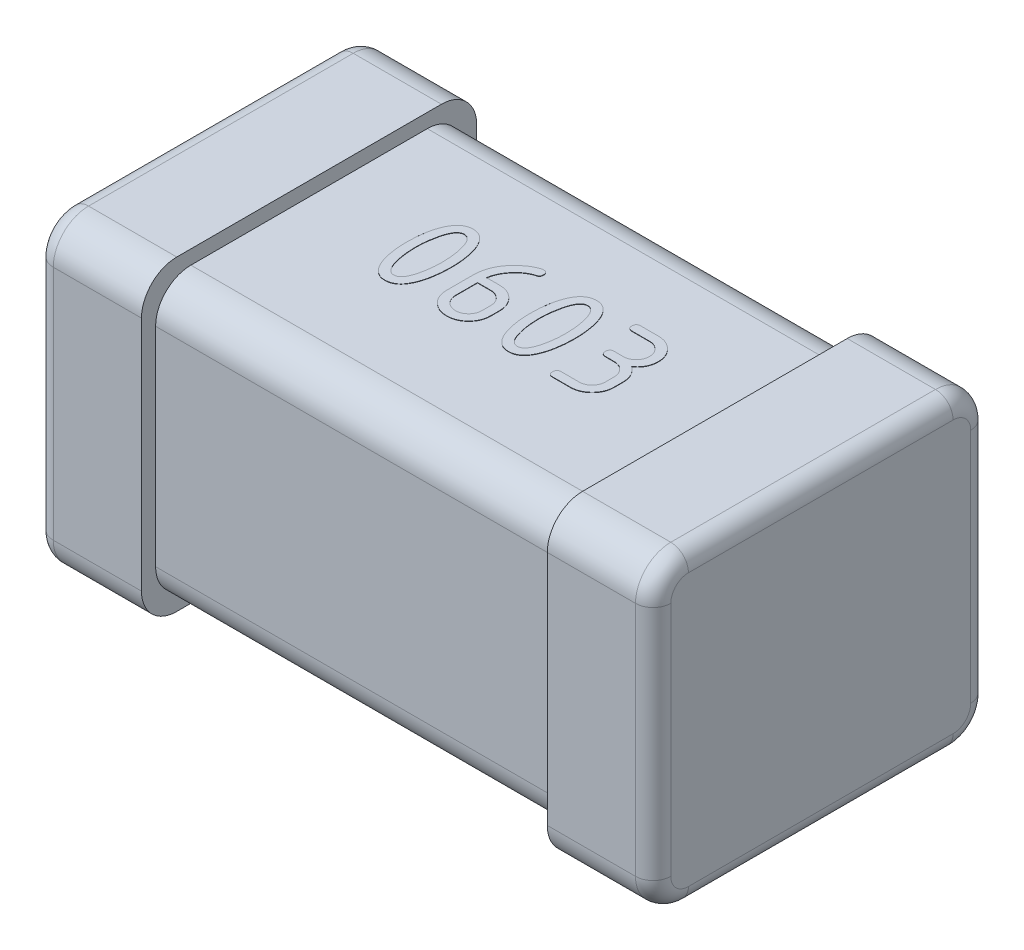
from build123d import *

# Parameters (mm, degrees)
SKETCH1_W               = 1.75
SKETCH1_H               = 0.95
BOSS_EXTRUDE1_DEPTH     = 0.435
CUT_EXTRUDE1_DEPTH      = 0.575
CUT_EXTRUDE1_DEPTH_BACK = 0.575
SKETCH3_OUTSIDE_W       = 3.384
SKETCH3_OUTSIDE_H       = 3.304
SKETCH3_OUTSIDE_W_2     = 0.87
SKETCH3_OUTSIDE_H_2     = 0.79
FILLET1_R               = 0.1
FILLET2_R               = 0.1
FILLET3_R               = 0.05
BOSS_EXTRUDE2_DEPTH     = 0.001


with BuildPart() as part:
    # Sketch1 → Boss-Extrude1 (new, symmetric)
    with BuildSketch(Plane(origin=(0, 0, 0), x_dir=(1, 0, 0), z_dir=(0, 1, 0))):
        Rectangle(SKETCH1_W, SKETCH1_H)
    extrude(amount=BOSS_EXTRUDE1_DEPTH, both=True)

    # Sketch3 outside → Cut-Extrude1 (cut, two sides: drawn at the far end of the back side and taken through both)
    with BuildSketch(Plane(origin=(0, 0, 0), x_dir=(0, 0, -1), z_dir=(1, 0, 0)).offset(-CUT_EXTRUDE1_DEPTH_BACK)):
        Rectangle(SKETCH3_OUTSIDE_W, SKETCH3_OUTSIDE_H)
        Rectangle(SKETCH3_OUTSIDE_W_2, SKETCH3_OUTSIDE_H_2, mode=Mode.SUBTRACT)
    extrude(amount=CUT_EXTRUDE1_DEPTH + CUT_EXTRUDE1_DEPTH_BACK, mode=Mode.SUBTRACT)

    # Fillet1
    fillet1_edges = [part.edges().sort_by_distance(p)[0] for p in [
        (0, -0.395, 0.435),
        (0, -0.395, -0.435),
        (0, 0.395, -0.435),
        (0, 0.395, 0.435),
    ]]
    fillet(fillet1_edges, radius=FILLET1_R)

    # Fillet2
    fillet2_edges = [part.edges().sort_by_distance(p)[0] for p in [
        (-0.725, 0.435, 0.475),
        (0.725, -0.435, 0.475),
        (-0.725, -0.435, -0.475),
        (-0.725, 0.435, -0.475),
        (0.725, 0.435, 0.475),
        (-0.725, -0.435, 0.475),
        (0.725, -0.435, -0.475),
        (0.725, 0.435, -0.475),
    ]]
    fillet(fillet2_edges, radius=FILLET2_R)

    # Fillet3
    fillet3_edges = [part.edges().sort_by_distance(p)[0] for p in [
        (-0.875, 0, 0.475),
        (-0.875, -0.435, 0),
        (-0.875, 0.435, 0),
        (-0.875, 0, -0.475),
        (-0.875, 0.405710678, -0.445710678),
        (-0.875, -0.405710678, -0.445710678),
        (-0.875, 0.405710678, 0.445710678),
        (-0.875, -0.405710678, 0.445710678),
        (0.875, 0.435, 0),
        (0.875, -0.435, 0),
        (0.875, 0, -0.475),
        (0.875, 0, 0.475),
        (0.875, -0.405710678, -0.445710678),
        (0.875, 0.405710678, -0.445710678),
        (0.875, -0.405710678, 0.445710678),
        (0.875, 0.405710678, 0.445710678),
    ]]
    fillet(fillet3_edges, radius=FILLET3_R)

    # Sketch4 → Boss-Extrude2 (add)
    # profile 1 of 4: a face of its own
    with BuildSketch(Plane(origin=(0, 0.395, 0), x_dir=(1, 0, 0), z_dir=(0, 1, 0))):
        with BuildLine():
            add(Edge.make_bspline(
                [(-0.2, 0.02730046), (-0.200033044, 0.023635617), (-0.20009799, 0.0164326), (-0.200582622, 0.00581958), (-0.201516315, -0.004410059), (-0.20262941, -0.014268898), (-0.204220371, -0.02373977), (-0.206116434, -0.032842832), (-0.208302775, -0.041591073), (-0.21010796, -0.047224568), (-0.210993304, -0.049987486)],
                knots=[0, 0, 0, 0, 1.121884543, 2.204992808, 3.251003932, 4.265943523, 5.241379217, 6.189508073, 7.112053941, 8, 8, 8, 8], degree=3))
            add(Edge.make_bspline(
                [(-0.210993304, -0.049987486), (-0.212342568, -0.053742483), (-0.214922293, -0.060921849), (-0.21992219, -0.070660434), (-0.225420323, -0.078997943), (-0.231620372, -0.08581499), (-0.238430946, -0.091168855), (-0.245901151, -0.09500186), (-0.254011373, -0.097314213), (-0.259639018, -0.09756967), (-0.2625, -0.09769954)],
                knots=[0, 0, 0, 0, 1.267950427, 2.424258098, 3.472816797, 4.435939713, 5.342465326, 6.213003319, 7.091526505, 8, 8, 8, 8], degree=3))
            add(Edge.make_bspline(
                [(-0.2625, -0.09769954), (-0.265360763, -0.097569393), (-0.270987977, -0.097313392), (-0.279101339, -0.095005008), (-0.28654948, -0.091162197), (-0.293399874, -0.085877638), (-0.299559534, -0.079056369), (-0.30508107, -0.070777463), (-0.310089072, -0.061075843), (-0.312659414, -0.053910641), (-0.314006696, -0.050154897)],
                knots=[0, 0, 0, 0, 0.910041478, 1.790080955, 2.662121456, 3.566587881, 4.531373102, 5.576831042, 6.729861149, 8, 8, 8, 8], degree=3))
            add(Edge.make_bspline(
                [(-0.314006696, -0.050154897), (-0.3148921, -0.047391989), (-0.316697408, -0.041758513), (-0.318882794, -0.033010118), (-0.320786397, -0.023889701), (-0.322364409, -0.014398102), (-0.323488366, -0.004503555), (-0.324414162, 0.005745483), (-0.324903524, 0.016395323), (-0.324967413, 0.023616991), (-0.325, 0.02730046)],
                knots=[0, 0, 0, 0, 0.886064917, 1.806656342, 2.752776557, 3.731751904, 4.744541313, 5.793997073, 6.874810739, 8, 8, 8, 8], degree=3))
            add(Edge.make_bspline(
                [(-0.325, 0.02730046), (-0.324967413, 0.030983929), (-0.324903524, 0.038205597), (-0.324414162, 0.048855437), (-0.323488366, 0.059104475), (-0.322364409, 0.068999022), (-0.320786397, 0.078490621), (-0.318882794, 0.087611038), (-0.316697408, 0.096359433), (-0.3148921, 0.101992909), (-0.314006696, 0.104755817)],
                knots=[0, 0, 0, 0, 1.125189261, 2.206002927, 3.255458687, 4.268248096, 5.247223443, 6.193343658, 7.113935083, 8, 8, 8, 8], degree=3))
            add(Edge.make_bspline(
                [(-0.314006696, 0.104755817), (-0.312659414, 0.108511561), (-0.310089072, 0.115676763), (-0.30508107, 0.125378383), (-0.299559534, 0.13365729), (-0.293399874, 0.140478559), (-0.28654948, 0.145763117), (-0.279101339, 0.149605928), (-0.270987977, 0.151914312), (-0.265360763, 0.152170314), (-0.2625, 0.15230046)],
                knots=[0, 0, 0, 0, 1.270138851, 2.423168958, 3.468626898, 4.433412119, 5.337878544, 6.209919045, 7.089958522, 8, 8, 8, 8], degree=3))
            add(Edge.make_bspline(
                [(-0.2625, 0.15230046), (-0.259639018, 0.152170591), (-0.254011373, 0.151915133), (-0.245901151, 0.149602781), (-0.238430946, 0.145769775), (-0.231620372, 0.14041591), (-0.225420323, 0.133598863), (-0.21992219, 0.125261354), (-0.214922293, 0.115522769), (-0.212342568, 0.108343403), (-0.210993304, 0.104588407)],
                knots=[0, 0, 0, 0, 0.908473495, 1.786996681, 2.657534674, 3.564060287, 4.527183203, 5.575741902, 6.732049573, 8, 8, 8, 8], degree=3))
            add(Edge.make_bspline(
                [(-0.210993304, 0.104588407), (-0.21010796, 0.101825489), (-0.208302775, 0.096191993), (-0.206116434, 0.087443752), (-0.204220371, 0.078340691), (-0.20262941, 0.068869818), (-0.201516315, 0.05901098), (-0.200582622, 0.048781341), (-0.20009799, 0.03816832), (-0.200033044, 0.030965304), (-0.2, 0.02730046)],
                knots=[0, 0, 0, 0, 0.887946059, 1.810491927, 2.758620783, 3.734056477, 4.748996068, 5.795007192, 6.878115457, 8, 8, 8, 8], degree=3))
        make_face()
        with BuildLine():
            add(Edge.make_bspline(
                [(-0.225, 0.02730046), (-0.225062082, 0.03240045), (-0.225184864, 0.042486915), (-0.226550479, 0.057366404), (-0.228525476, 0.071826762), (-0.230609362, 0.081199883), (-0.231640625, 0.085838407)],
                knots=[0, 0, 0, 0, 1.036187695, 2.04931225, 3.03465332, 4, 4, 4, 4], degree=3))
            add(Edge.make_bspline(
                [(-0.231640625, 0.085838407), (-0.232483179, 0.089089963), (-0.234074302, 0.095230375), (-0.237086687, 0.103691097), (-0.240375158, 0.110897327), (-0.244082549, 0.116797258), (-0.248077267, 0.121516356), (-0.252558499, 0.124846801), (-0.257425302, 0.126897224), (-0.260807338, 0.127165961), (-0.2625, 0.12730046)],
                knots=[0, 0, 0, 0, 1.452784662, 2.743516012, 3.881318599, 4.872714509, 5.751019032, 6.539832634, 7.269206463, 8, 8, 8, 8], degree=3))
            add(Edge.make_bspline(
                [(-0.2625, 0.12730046), (-0.264195478, 0.127173232), (-0.267573014, 0.126919782), (-0.272374463, 0.124773302), (-0.276815796, 0.121462467), (-0.280762706, 0.116713073), (-0.284442286, 0.110795985), (-0.287760038, 0.103566328), (-0.290754701, 0.095060827), (-0.292348306, 0.088884796), (-0.293191964, 0.085615192)],
                knots=[0, 0, 0, 0, 0.73024413, 1.454707756, 2.2364598, 3.108818404, 4.106268943, 5.243216136, 6.540552912, 8, 8, 8, 8], degree=3))
            add(Edge.make_bspline(
                [(-0.293191964, 0.085615192), (-0.294238032, 0.080901838), (-0.29633546, 0.071451283), (-0.298405273, 0.056980342), (-0.29973804, 0.042243824), (-0.299912232, 0.032307124), (-0.3, 0.02730046)],
                knots=[0, 0, 0, 0, 0.984359877, 1.973700231, 2.979037069, 4, 4, 4, 4], degree=3))
            add(Edge.make_bspline(
                [(-0.3, 0.02730046), (-0.299937956, 0.02221907), (-0.299815254, 0.012169742), (-0.298447538, -0.002672521), (-0.296463074, -0.017148986), (-0.294389497, -0.026561494), (-0.293359375, -0.031237486)],
                knots=[0, 0, 0, 0, 1.032445105, 2.041839016, 3.027215061, 4, 4, 4, 4], degree=3))
            add(Edge.make_bspline(
                [(-0.293359375, -0.031237486), (-0.292516821, -0.034489043), (-0.290925698, -0.040629455), (-0.287913313, -0.049090177), (-0.284624842, -0.056296407), (-0.280917451, -0.062196337), (-0.276922733, -0.066915436), (-0.272441501, -0.07024588), (-0.267574698, -0.072296304), (-0.264192662, -0.072565041), (-0.2625, -0.07269954)],
                knots=[0, 0, 0, 0, 1.452784662, 2.743516012, 3.881318599, 4.872714509, 5.751019032, 6.539832634, 7.269206463, 8, 8, 8, 8], degree=3))
            add(Edge.make_bspline(
                [(-0.2625, -0.07269954), (-0.260807338, -0.072565041), (-0.257425302, -0.072296304), (-0.252558499, -0.07024588), (-0.248077267, -0.066915436), (-0.244082549, -0.062196337), (-0.240375158, -0.056296407), (-0.237086687, -0.049090177), (-0.234074302, -0.040629455), (-0.232483179, -0.034489043), (-0.231640625, -0.031237486)],
                knots=[0, 0, 0, 0, 0.730793537, 1.460167366, 2.248980968, 3.127285491, 4.118681401, 5.256483988, 6.547215338, 8, 8, 8, 8], degree=3))
            add(Edge.make_bspline(
                [(-0.231640625, -0.031237486), (-0.230610503, -0.026561494), (-0.228536926, -0.017148986), (-0.226552462, -0.002672521), (-0.225184746, 0.012169742), (-0.225062044, 0.02221907), (-0.225, 0.02730046)],
                knots=[0, 0, 0, 0, 0.972784939, 1.958160984, 2.967554895, 4, 4, 4, 4], degree=3))
        make_face(mode=Mode.SUBTRACT)
    # profile 2 of 4: a face of its own
    with BuildSketch(Plane(origin=(0, 0.395, 0), x_dir=(1, 0, 0), z_dir=(0, 1, 0))):
        with BuildLine():
            add(Edge.make_bspline(
                [(-0.063002232, 0.15230046), (-0.062030299, 0.152282675), (-0.060175804, 0.152248741), (-0.057616902, 0.151611421), (-0.055379948, 0.150688674), (-0.053639656, 0.149219864), (-0.052152438, 0.14746749), (-0.051270576, 0.145214589), (-0.05059617, 0.142648942), (-0.050571311, 0.140792044), (-0.050558036, 0.13980046)],
                knots=[0, 0, 0, 0, 1.149127283, 2.192588307, 3.111010819, 3.989618166, 4.868225514, 5.806829786, 6.828846735, 8, 8, 8, 8], degree=3))
            add(Edge.make_bspline(
                [(-0.050558036, 0.13980046), (-0.050613368, 0.138411048), (-0.050713919, 0.13588616), (-0.051883656, 0.132557766), (-0.053874985, 0.12999887), (-0.055785866, 0.129355656), (-0.056752232, 0.129030371)],
                knots=[0, 0, 0, 0, 1.232238735, 2.239267552, 3.109566226, 4, 4, 4, 4], degree=3))
            add(Edge.make_bspline(
                [(-0.056752232, 0.129030371), (-0.059035686, 0.128384571), (-0.063617439, 0.127088772), (-0.070234533, 0.12437608), (-0.076647806, 0.121129309), (-0.082831437, 0.117245177), (-0.088776323, 0.112711468), (-0.094531021, 0.107631174), (-0.100062543, 0.10194719), (-0.10345363, 0.097788777), (-0.105189732, 0.095659835)],
                knots=[0, 0, 0, 0, 0.950015125, 1.906206054, 2.859343213, 3.826964505, 4.827011958, 5.851200071, 6.899899847, 8, 8, 8, 8], degree=3))
            add(Edge.make_bspline(
                [(-0.105189732, 0.095659835), (-0.106512108, 0.093926057), (-0.109105011, 0.090526477), (-0.112594452, 0.085246105), (-0.115612268, 0.079891766), (-0.118160428, 0.074466771), (-0.120388135, 0.069028987), (-0.122095163, 0.06351629), (-0.123411881, 0.057940357), (-0.123949246, 0.054184251), (-0.12421875, 0.05230046)],
                knots=[0, 0, 0, 0, 1.090887248, 2.139003248, 3.164220545, 4.163461421, 5.136566647, 6.102164336, 7.048183393, 8, 8, 8, 8], degree=3))
            Line((-0.12421875, 0.05230046), (-0.087611607, 0.05230046))
            add(Edge.make_bspline(
                [(-0.087611607, 0.05230046), (-0.085432866, 0.052248047), (-0.081170227, 0.052145503), (-0.074899797, 0.051303506), (-0.068921643, 0.049811868), (-0.063144103, 0.047914897), (-0.057695696, 0.045278477), (-0.052466311, 0.04216944), (-0.04757283, 0.038391119), (-0.042946372, 0.034168722), (-0.03874292, 0.029545939), (-0.03511128, 0.024579913), (-0.031923557, 0.019450199), (-0.029436662, 0.013972125), (-0.027390918, 0.008292544), (-0.026022802, 0.002333708), (-0.025150495, -0.003849129), (-0.025050766, -0.008057361), (-0.025, -0.01019954)],
                knots=[0, 0, 0, 0, 1.06003907, 2.073932809, 3.070670024, 4.055373752, 5.027136545, 6.009799521, 7.010965971, 8.029656801, 9.055041837, 10.045346293, 11.020265877, 11.988184607, 12.967297412, 13.953123832, 14.958047937, 16, 16, 16, 16], degree=3))
            Line((-0.025, -0.01019954), (-0.025, -0.03519954))
            add(Edge.make_bspline(
                [(-0.025, -0.03519954), (-0.025052385, -0.037341331), (-0.025155293, -0.041548799), (-0.026005141, -0.047741487), (-0.027455917, -0.053666942), (-0.029499126, -0.059358872), (-0.032037735, -0.064819359), (-0.035209198, -0.07001611), (-0.038978821, -0.074924486), (-0.043220184, -0.079574525), (-0.047904547, -0.083773976), (-0.052800805, -0.087566576), (-0.058003115, -0.090679778), (-0.063447617, -0.093231576), (-0.069114037, -0.095221437), (-0.075029675, -0.096704425), (-0.081188636, -0.097539661), (-0.085377039, -0.097645761), (-0.0875, -0.09769954)],
                knots=[0, 0, 0, 0, 1.044697895, 2.052270253, 3.042817334, 4.015956711, 4.998488445, 5.975977212, 6.979782012, 8.013980164, 9.042067373, 10.045872174, 11.031124738, 11.993368833, 12.975061871, 13.956796861, 14.964369219, 16, 16, 16, 16], degree=3))
            add(Edge.make_bspline(
                [(-0.0875, -0.09769954), (-0.089641622, -0.097646689), (-0.09384876, -0.097542867), (-0.100043848, -0.096699654), (-0.105954457, -0.095225901), (-0.111673278, -0.093275322), (-0.117102462, -0.090704714), (-0.122316994, -0.087608718), (-0.127224029, -0.083889046), (-0.131870879, -0.079702044), (-0.136093436, -0.075071548), (-0.139845976, -0.070183112), (-0.142998396, -0.065023433), (-0.14551613, -0.059598965), (-0.14753385, -0.053961995), (-0.14900277, -0.048059692), (-0.149840674, -0.041901737), (-0.149946407, -0.037713195), (-0.15, -0.035590165)],
                knots=[0, 0, 0, 0, 1.047467757, 2.057711544, 3.050884915, 4.023586971, 5.008723743, 5.984103727, 6.985083748, 8.015896779, 9.039980167, 10.046446407, 11.02652684, 11.991322183, 12.967041695, 13.95137961, 14.961623397, 16, 16, 16, 16], degree=3))
            Line((-0.15, -0.035590165), (-0.15, 0.03980046))
            add(Edge.make_bspline(
                [(-0.15, 0.03980046), (-0.149910222, 0.043282449), (-0.149732928, 0.050158702), (-0.148441176, 0.060330525), (-0.146186384, 0.070163832), (-0.143119174, 0.079673742), (-0.139196445, 0.088869045), (-0.134276902, 0.097674076), (-0.128637944, 0.106277463), (-0.124181867, 0.111569209), (-0.121930804, 0.114242424)],
                knots=[0, 0, 0, 0, 1.026888328, 2.027905323, 3.018129285, 3.998408978, 4.97166259, 5.961232793, 6.970082345, 8, 8, 8, 8], degree=3))
            add(Edge.make_bspline(
                [(-0.121930804, 0.114242424), (-0.120109716, 0.116252225), (-0.116521827, 0.120211916), (-0.110865182, 0.12573124), (-0.105115008, 0.130845661), (-0.099191612, 0.135463078), (-0.093180543, 0.139678973), (-0.086994133, 0.143343359), (-0.080750838, 0.146698452), (-0.076428814, 0.148537718), (-0.074274554, 0.149454478)],
                knots=[0, 0, 0, 0, 1.088440724, 2.144436125, 3.170658062, 4.175885474, 5.157656593, 6.11548443, 7.060685782, 8, 8, 8, 8], degree=3))
            add(Edge.make_bspline(
                [(-0.074274554, 0.149454478), (-0.073125628, 0.149877429), (-0.070993109, 0.150662466), (-0.067958783, 0.151558766), (-0.065352874, 0.152185652), (-0.063730329, 0.152264899), (-0.063002232, 0.15230046)],
                knots=[0, 0, 0, 0, 1.257435182, 2.33392164, 3.252368318, 4, 4, 4, 4], degree=3))
        make_face()
        with BuildLine():
            Line((-0.125, 0.02730046), (-0.125, -0.03519954))
            add(Edge.make_bspline(
                [(-0.125, -0.03519954), (-0.124886847, -0.037745545), (-0.124666447, -0.042704671), (-0.122477131, -0.049800128), (-0.119026295, -0.05627479), (-0.114279636, -0.061979176), (-0.108575251, -0.066725834), (-0.102100589, -0.070176671), (-0.095005131, -0.072365987), (-0.090046005, -0.072586387), (-0.0875, -0.07269954)],
                knots=[0, 0, 0, 0, 1.032801548, 2.011697431, 2.989774545, 4, 5.010225455, 5.988302569, 6.967198452, 8, 8, 8, 8], degree=3))
            add(Edge.make_bspline(
                [(-0.0875, -0.07269954), (-0.084954585, -0.07258523), (-0.07999661, -0.072362576), (-0.072884338, -0.070186873), (-0.066423926, -0.066662003), (-0.060713355, -0.061868251), (-0.056007248, -0.056122304), (-0.052506451, -0.049679318), (-0.050347682, -0.042627221), (-0.050117387, -0.037707332), (-0.05, -0.03519954)],
                knots=[0, 0, 0, 0, 1.033766068, 2.013576129, 2.996161655, 4.012166741, 5.029187042, 6.001507999, 6.981318061, 8, 8, 8, 8], degree=3))
            Line((-0.05, -0.03519954), (-0.05, -0.01019954))
            add(Edge.make_bspline(
                [(-0.05, -0.01019954), (-0.05011431, -0.007654125), (-0.050336964, -0.00269615), (-0.052512667, 0.004416122), (-0.056037537, 0.010876534), (-0.060831289, 0.016587105), (-0.066577235, 0.021293212), (-0.073020222, 0.024794009), (-0.080072319, 0.026952778), (-0.084992208, 0.027183073), (-0.0875, 0.02730046)],
                knots=[0, 0, 0, 0, 1.033766068, 2.013576129, 2.996161655, 4.012166741, 5.029187042, 6.001507999, 6.981318061, 8, 8, 8, 8], degree=3))
            Line((-0.0875, 0.02730046), (-0.125, 0.02730046))
        make_face(mode=Mode.SUBTRACT)
    # profile 3 of 4: a face of its own
    with BuildSketch(Plane(origin=(0, 0.395, 0), x_dir=(1, 0, 0), z_dir=(0, 1, 0))):
        with BuildLine():
            add(Edge.make_bspline(
                [(0.15, 0.02730046), (0.149966956, 0.023635617), (0.14990201, 0.0164326), (0.149417378, 0.00581958), (0.148483685, -0.004410059), (0.14737059, -0.014268898), (0.145779629, -0.02373977), (0.143883566, -0.032842832), (0.141697225, -0.041591073), (0.13989204, -0.047224568), (0.139006696, -0.049987486)],
                knots=[0, 0, 0, 0, 1.121884543, 2.204992808, 3.251003932, 4.265943523, 5.241379217, 6.189508073, 7.112053941, 8, 8, 8, 8], degree=3))
            add(Edge.make_bspline(
                [(0.139006696, -0.049987486), (0.137657432, -0.053742483), (0.135077707, -0.060921849), (0.13007781, -0.070660434), (0.124579677, -0.078997943), (0.118379628, -0.08581499), (0.111569054, -0.091168855), (0.104098849, -0.09500186), (0.095988627, -0.097314213), (0.090360982, -0.09756967), (0.0875, -0.09769954)],
                knots=[0, 0, 0, 0, 1.267950427, 2.424258098, 3.472816797, 4.435939713, 5.342465326, 6.213003319, 7.091526505, 8, 8, 8, 8], degree=3))
            add(Edge.make_bspline(
                [(0.0875, -0.09769954), (0.084639237, -0.097569393), (0.079012023, -0.097313392), (0.070898661, -0.095005008), (0.06345052, -0.091162197), (0.056600126, -0.085877638), (0.050440466, -0.079056369), (0.04491893, -0.070777463), (0.039910928, -0.061075843), (0.037340586, -0.053910641), (0.035993304, -0.050154897)],
                knots=[0, 0, 0, 0, 0.910041478, 1.790080955, 2.662121456, 3.566587881, 4.531373102, 5.576831042, 6.729861149, 8, 8, 8, 8], degree=3))
            add(Edge.make_bspline(
                [(0.035993304, -0.050154897), (0.0351079, -0.047391989), (0.033302592, -0.041758513), (0.031117206, -0.033010118), (0.029213603, -0.023889701), (0.027635591, -0.014398102), (0.026511634, -0.004503555), (0.025585838, 0.005745483), (0.025096476, 0.016395323), (0.025032587, 0.023616991), (0.025, 0.02730046)],
                knots=[0, 0, 0, 0, 0.886064917, 1.806656342, 2.752776557, 3.731751904, 4.744541313, 5.793997073, 6.874810739, 8, 8, 8, 8], degree=3))
            add(Edge.make_bspline(
                [(0.025, 0.02730046), (0.025032587, 0.030983929), (0.025096476, 0.038205597), (0.025585838, 0.048855437), (0.026511634, 0.059104475), (0.027635591, 0.068999022), (0.029213603, 0.078490621), (0.031117206, 0.087611038), (0.033302592, 0.096359433), (0.0351079, 0.101992909), (0.035993304, 0.104755817)],
                knots=[0, 0, 0, 0, 1.125189261, 2.206002927, 3.255458687, 4.268248096, 5.247223443, 6.193343658, 7.113935083, 8, 8, 8, 8], degree=3))
            add(Edge.make_bspline(
                [(0.035993304, 0.104755817), (0.037340586, 0.108511561), (0.039910928, 0.115676763), (0.04491893, 0.125378383), (0.050440466, 0.13365729), (0.056600126, 0.140478559), (0.06345052, 0.145763117), (0.070898661, 0.149605928), (0.079012023, 0.151914312), (0.084639237, 0.152170314), (0.0875, 0.15230046)],
                knots=[0, 0, 0, 0, 1.270138851, 2.423168958, 3.468626898, 4.433412119, 5.337878544, 6.209919045, 7.089958522, 8, 8, 8, 8], degree=3))
            add(Edge.make_bspline(
                [(0.0875, 0.15230046), (0.090360982, 0.152170591), (0.095988627, 0.151915133), (0.104098849, 0.149602781), (0.111569054, 0.145769775), (0.118379628, 0.14041591), (0.124579677, 0.133598863), (0.13007781, 0.125261354), (0.135077707, 0.115522769), (0.137657432, 0.108343403), (0.139006696, 0.104588407)],
                knots=[0, 0, 0, 0, 0.908473495, 1.786996681, 2.657534674, 3.564060287, 4.527183203, 5.575741902, 6.732049573, 8, 8, 8, 8], degree=3))
            add(Edge.make_bspline(
                [(0.139006696, 0.104588407), (0.13989204, 0.101825489), (0.141697225, 0.096191993), (0.143883566, 0.087443752), (0.145779629, 0.078340691), (0.14737059, 0.068869818), (0.148483685, 0.05901098), (0.149417378, 0.048781341), (0.14990201, 0.03816832), (0.149966956, 0.030965304), (0.15, 0.02730046)],
                knots=[0, 0, 0, 0, 0.887946059, 1.810491927, 2.758620783, 3.734056477, 4.748996068, 5.795007192, 6.878115457, 8, 8, 8, 8], degree=3))
        make_face()
        with BuildLine():
            add(Edge.make_bspline(
                [(0.125, 0.02730046), (0.124937918, 0.03240045), (0.124815136, 0.042486915), (0.123449521, 0.057366404), (0.121474524, 0.071826762), (0.119390638, 0.081199883), (0.118359375, 0.085838407)],
                knots=[0, 0, 0, 0, 1.036187695, 2.04931225, 3.03465332, 4, 4, 4, 4], degree=3))
            add(Edge.make_bspline(
                [(0.118359375, 0.085838407), (0.117516821, 0.089089963), (0.115925698, 0.095230375), (0.112913313, 0.103691097), (0.109624842, 0.110897327), (0.105917451, 0.116797258), (0.101922733, 0.121516356), (0.097441501, 0.124846801), (0.092574698, 0.126897224), (0.089192662, 0.127165961), (0.0875, 0.12730046)],
                knots=[0, 0, 0, 0, 1.452784662, 2.743516012, 3.881318599, 4.872714509, 5.751019032, 6.539832634, 7.269206463, 8, 8, 8, 8], degree=3))
            add(Edge.make_bspline(
                [(0.0875, 0.12730046), (0.085804522, 0.127173232), (0.082426986, 0.126919782), (0.077625537, 0.124773302), (0.073184204, 0.121462467), (0.069237294, 0.116713073), (0.065557714, 0.110795985), (0.062239962, 0.103566328), (0.059245299, 0.095060827), (0.057651694, 0.088884796), (0.056808036, 0.085615192)],
                knots=[0, 0, 0, 0, 0.73024413, 1.454707756, 2.2364598, 3.108818404, 4.106268943, 5.243216136, 6.540552912, 8, 8, 8, 8], degree=3))
            add(Edge.make_bspline(
                [(0.056808036, 0.085615192), (0.055761968, 0.080901838), (0.05366454, 0.071451283), (0.051594727, 0.056980342), (0.05026196, 0.042243824), (0.050087768, 0.032307124), (0.05, 0.02730046)],
                knots=[0, 0, 0, 0, 0.984359877, 1.973700231, 2.979037069, 4, 4, 4, 4], degree=3))
            add(Edge.make_bspline(
                [(0.05, 0.02730046), (0.050062044, 0.02221907), (0.050184746, 0.012169742), (0.051552462, -0.002672521), (0.053536926, -0.017148986), (0.055610503, -0.026561494), (0.056640625, -0.031237486)],
                knots=[0, 0, 0, 0, 1.032445105, 2.041839016, 3.027215061, 4, 4, 4, 4], degree=3))
            add(Edge.make_bspline(
                [(0.056640625, -0.031237486), (0.057483179, -0.034489043), (0.059074302, -0.040629455), (0.062086687, -0.049090177), (0.065375158, -0.056296407), (0.069082549, -0.062196337), (0.073077267, -0.066915436), (0.077558499, -0.07024588), (0.082425302, -0.072296304), (0.085807338, -0.072565041), (0.0875, -0.07269954)],
                knots=[0, 0, 0, 0, 1.452784662, 2.743516012, 3.881318599, 4.872714509, 5.751019032, 6.539832634, 7.269206463, 8, 8, 8, 8], degree=3))
            add(Edge.make_bspline(
                [(0.0875, -0.07269954), (0.089192662, -0.072565041), (0.092574698, -0.072296304), (0.097441501, -0.07024588), (0.101922733, -0.066915436), (0.105917451, -0.062196337), (0.109624842, -0.056296407), (0.112913313, -0.049090177), (0.115925698, -0.040629455), (0.117516821, -0.034489043), (0.118359375, -0.031237486)],
                knots=[0, 0, 0, 0, 0.730793537, 1.460167366, 2.248980968, 3.127285491, 4.118681401, 5.256483988, 6.547215338, 8, 8, 8, 8], degree=3))
            add(Edge.make_bspline(
                [(0.118359375, -0.031237486), (0.119389497, -0.026561494), (0.121463074, -0.017148986), (0.123447538, -0.002672521), (0.124815254, 0.012169742), (0.124937956, 0.02221907), (0.125, 0.02730046)],
                knots=[0, 0, 0, 0, 0.972784939, 1.958160984, 2.967554895, 4, 4, 4, 4], degree=3))
        make_face(mode=Mode.SUBTRACT)
    # profile 4 of 4: a face of its own
    with BuildSketch(Plane(origin=(0, 0.395, 0), x_dir=(1, 0, 0), z_dir=(0, 1, 0))):
        with BuildLine():
            Line((0.2625, 0.02730046), (0.2375, 0.02730046))
            add(Edge.make_bspline(
                [(0.2375, 0.02730046), (0.236531724, 0.027351783), (0.234689473, 0.027449431), (0.232082246, 0.027945337), (0.229916241, 0.029015131), (0.228032149, 0.030332609), (0.22671467, 0.032216701), (0.225644877, 0.034382706), (0.225148971, 0.036989933), (0.225051323, 0.038832185), (0.225, 0.03980046)],
                knots=[0, 0, 0, 0, 1.150813752, 2.189550435, 3.117366144, 4, 4.882633856, 5.810449565, 6.849186248, 8, 8, 8, 8], degree=3))
            add(Edge.make_bspline(
                [(0.225, 0.03980046), (0.225046803, 0.040788724), (0.225134197, 0.042634111), (0.225673106, 0.045242176), (0.226676365, 0.047429813), (0.228074157, 0.049260271), (0.229878254, 0.050668101), (0.232110288, 0.051616055), (0.234674862, 0.052247378), (0.23652851, 0.052282207), (0.2375, 0.05230046)],
                knots=[0, 0, 0, 0, 1.171278472, 2.187130384, 3.133692503, 3.997641031, 4.892513739, 5.809895742, 6.852174597, 8, 8, 8, 8], degree=3))
            Line((0.2375, 0.05230046), (0.2625, 0.05230046))
            add(Edge.make_bspline(
                [(0.2625, 0.05230046), (0.265046005, 0.052413613), (0.270005131, 0.052634013), (0.277100589, 0.054823329), (0.283575251, 0.058274166), (0.289279636, 0.063020824), (0.294026295, 0.06872521), (0.297477131, 0.075199872), (0.299666447, 0.082295329), (0.299886847, 0.087254455), (0.3, 0.08980046)],
                knots=[0, 0, 0, 0, 1.032801548, 2.011697431, 2.989774545, 4, 5.010225455, 5.988302569, 6.967198452, 8, 8, 8, 8], degree=3))
            add(Edge.make_bspline(
                [(0.3, 0.08980046), (0.299881476, 0.092307664), (0.29964895, 0.097226398), (0.29750377, 0.104295485), (0.293928693, 0.11072361), (0.289175883, 0.116476343), (0.28342315, 0.121229153), (0.276995025, 0.12480423), (0.269925938, 0.12694941), (0.265007203, 0.127181936), (0.2625, 0.12730046)],
                knots=[0, 0, 0, 0, 1.01963496, 2.000361676, 2.977215234, 4, 5.022784766, 5.999638324, 6.98036504, 8, 8, 8, 8], degree=3))
            Line((0.2625, 0.12730046), (0.2125, 0.12730046))
            add(Edge.make_bspline(
                [(0.2125, 0.12730046), (0.211531724, 0.127351783), (0.209689473, 0.127449431), (0.207082246, 0.127945337), (0.204916241, 0.129015131), (0.203032149, 0.130332609), (0.20171467, 0.132216701), (0.200644877, 0.134382706), (0.200148971, 0.136989933), (0.200051323, 0.138832185), (0.2, 0.13980046)],
                knots=[0, 0, 0, 0, 1.150813752, 2.189550435, 3.117366144, 4, 4.882633856, 5.810449565, 6.849186248, 8, 8, 8, 8], degree=3))
            add(Edge.make_bspline(
                [(0.2, 0.13980046), (0.200046803, 0.140788724), (0.200134197, 0.142634111), (0.200673106, 0.145242176), (0.201676365, 0.147429813), (0.203074157, 0.149260271), (0.204878254, 0.150668101), (0.207110288, 0.151616055), (0.209674862, 0.152247378), (0.21152851, 0.152282207), (0.2125, 0.15230046)],
                knots=[0, 0, 0, 0, 1.171278472, 2.187130384, 3.133692503, 3.997641031, 4.892513739, 5.809895742, 6.852174597, 8, 8, 8, 8], degree=3))
            Line((0.2125, 0.15230046), (0.2625, 0.15230046))
            add(Edge.make_bspline(
                [(0.2625, 0.15230046), (0.264624186, 0.152254628), (0.268817603, 0.152164148), (0.27495715, 0.151214524), (0.280891298, 0.149836438), (0.286581899, 0.14785374), (0.2919677, 0.145145558), (0.297200934, 0.142061962), (0.302114469, 0.138264236), (0.306758688, 0.134004519), (0.311043078, 0.129357007), (0.31477464, 0.124399302), (0.317948609, 0.119210088), (0.320515212, 0.113780109), (0.322531834, 0.108115593), (0.32400335, 0.102214429), (0.324837917, 0.096074629), (0.324945637, 0.091904827), (0.325, 0.08980046)],
                knots=[0, 0, 0, 0, 1.036592186, 2.046367411, 3.026869952, 4.009474324, 4.98046233, 5.966629532, 6.971366193, 8.00652442, 9.041682647, 10.053662, 11.032058197, 12.007286346, 12.981329115, 13.963975477, 14.972483193, 16, 16, 16, 16], degree=3))
            add(Edge.make_bspline(
                [(0.325, 0.08980046), (0.324935298, 0.087264737), (0.32480842, 0.082292306), (0.323506397, 0.075058001), (0.321595852, 0.068176742), (0.318756441, 0.061693567), (0.315109909, 0.055588712), (0.310656604, 0.049870064), (0.305446687, 0.044514161), (0.301470852, 0.041393135), (0.299441964, 0.03980046)],
                knots=[0, 0, 0, 0, 1.040763239, 2.040887161, 3.010889577, 3.969260993, 4.939173083, 5.925181052, 6.941209693, 8, 8, 8, 8], degree=3))
            add(Edge.make_bspline(
                [(0.299441964, 0.03980046), (0.30147059, 0.038207637), (0.30544591, 0.035086319), (0.31065953, 0.029732513), (0.315089563, 0.024018866), (0.318787961, 0.017942393), (0.321580509, 0.011435617), (0.323509371, 0.004544312), (0.324807631, -0.002691755), (0.324935031, -0.007663942), (0.325, -0.01019954)],
                knots=[0, 0, 0, 0, 1.058729764, 2.074700307, 3.060651894, 4.02395281, 4.989282591, 5.95922954, 6.959296274, 8, 8, 8, 8], degree=3))
            Line((0.325, -0.01019954), (0.325, -0.03519954))
            add(Edge.make_bspline(
                [(0.325, -0.03519954), (0.324954244, -0.037323766), (0.324863916, -0.041517263), (0.323913189, -0.047656228), (0.322539159, -0.053592514), (0.32053586, -0.059291008), (0.317880425, -0.064705787), (0.314723107, -0.069911775), (0.310987411, -0.074869038), (0.306697771, -0.079507799), (0.302075979, -0.083805312), (0.29707985, -0.087467473), (0.291912128, -0.090651453), (0.286478981, -0.09321387), (0.280815313, -0.095231613), (0.274913919, -0.096702824), (0.268774182, -0.097537473), (0.264604371, -0.097645182), (0.2625, -0.09769954)],
                knots=[0, 0, 0, 0, 1.03644959, 2.046085907, 3.026453569, 4.008922771, 4.987943079, 5.966204685, 6.978044827, 8.013060656, 9.048076484, 10.054479993, 11.032741599, 12.007835593, 12.981744371, 13.964255558, 14.972624541, 16, 16, 16, 16], degree=3))
            Line((0.2625, -0.09769954), (0.2125, -0.09769954))
            add(Edge.make_bspline(
                [(0.2125, -0.09769954), (0.211531724, -0.097648217), (0.209689473, -0.097550569), (0.207082246, -0.097054663), (0.204916241, -0.095984869), (0.203032149, -0.094667391), (0.20171467, -0.092783299), (0.200644877, -0.090617294), (0.200148971, -0.088010067), (0.200051323, -0.086167815), (0.2, -0.08519954)],
                knots=[0, 0, 0, 0, 1.150813752, 2.189550435, 3.117366144, 4, 4.882633856, 5.810449565, 6.849186248, 8, 8, 8, 8], degree=3))
            add(Edge.make_bspline(
                [(0.2, -0.08519954), (0.200046803, -0.084211276), (0.200134197, -0.082365889), (0.200673106, -0.079757824), (0.201676365, -0.077570187), (0.203074157, -0.075739729), (0.204878254, -0.074331899), (0.207110288, -0.073383945), (0.209674862, -0.072752622), (0.21152851, -0.072717793), (0.2125, -0.07269954)],
                knots=[0, 0, 0, 0, 1.171278472, 2.187130384, 3.133692503, 3.997641031, 4.892513739, 5.809895742, 6.852174597, 8, 8, 8, 8], degree=3))
            Line((0.2125, -0.07269954), (0.2625, -0.07269954))
            add(Edge.make_bspline(
                [(0.2625, -0.07269954), (0.265046005, -0.072586387), (0.270005131, -0.072365987), (0.277100589, -0.070176671), (0.283575251, -0.066725834), (0.289279636, -0.061979176), (0.294026295, -0.05627479), (0.297477131, -0.049800128), (0.299666447, -0.042704671), (0.299886847, -0.037745545), (0.3, -0.03519954)],
                knots=[0, 0, 0, 0, 1.032801548, 2.011697431, 2.989774545, 4, 5.010225455, 5.988302569, 6.967198452, 8, 8, 8, 8], degree=3))
            Line((0.3, -0.03519954), (0.3, -0.01019954))
            add(Edge.make_bspline(
                [(0.3, -0.01019954), (0.299881476, -0.007692336), (0.29964895, -0.002773602), (0.29750377, 0.004295485), (0.293928693, 0.01072361), (0.289175883, 0.016476343), (0.28342315, 0.021229153), (0.276995025, 0.02480423), (0.269925938, 0.02694941), (0.265007203, 0.027181936), (0.2625, 0.02730046)],
                knots=[0, 0, 0, 0, 1.01963496, 2.000361676, 2.977215234, 4, 5.022784766, 5.999638324, 6.98036504, 8, 8, 8, 8], degree=3))
        make_face()
    extrude(amount=BOSS_EXTRUDE2_DEPTH)


solid = part.part
